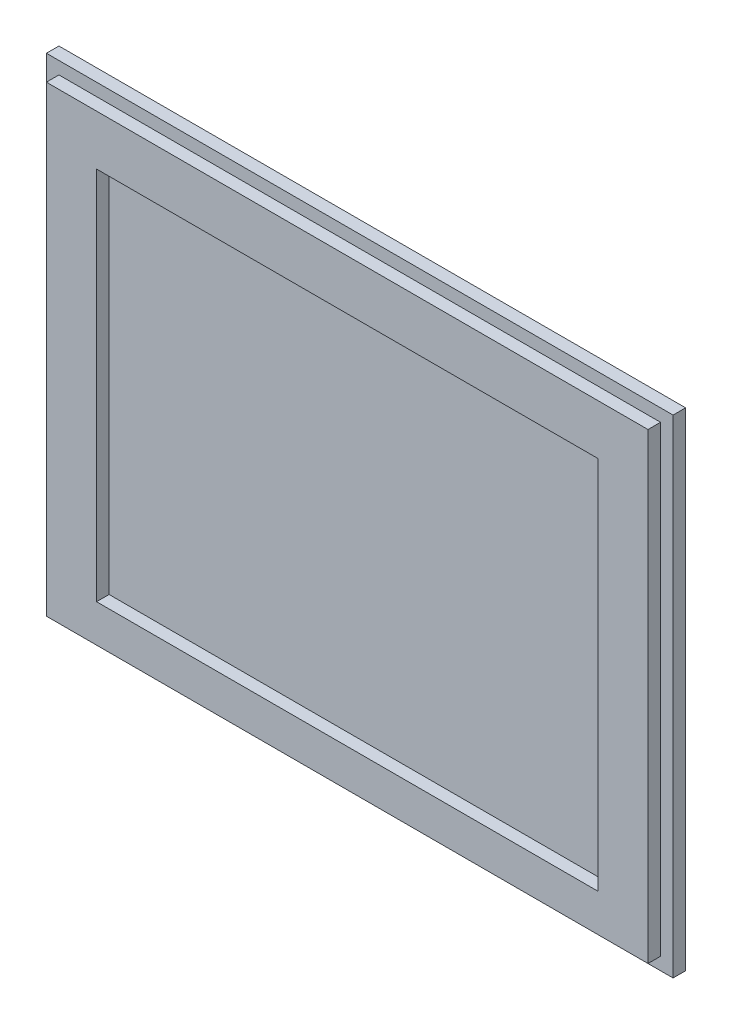
from build123d import *

# Parameters (mm, degrees)
SKIZZE1_W                       = 250
SKIZZE1_H                       = 194.5
AUFSATZ_LINEAR_AUSTRAGEN1_DEPTH = 5
SKIZZE2_W                       = 240
SKIZZE2_H                       = 184.5
SKIZZE2_W_2                     = 200
SKIZZE2_H_2                     = 149.5
AUFSATZ_LINEAR_AUSTRAGEN2_DEPTH = 5


with BuildPart() as part:
    # Skizze1 → Aufsatz-Linear austragen1 (new body)
    with BuildSketch(Plane.XY):
        with Locations((-5.266700495, 1.797169811)):
            Rectangle(SKIZZE1_W, SKIZZE1_H)
    extrude(amount=AUFSATZ_LINEAR_AUSTRAGEN1_DEPTH)

    # Skizze2 → Aufsatz-Linear austragen2 (add)
    with BuildSketch(Plane.XY.offset(5)):
        with Locations((-5.266700495, 1.797169811)):
            Rectangle(SKIZZE2_W, SKIZZE2_H)
        with Locations((-5.266700495, -0.702830189)):
            Rectangle(SKIZZE2_W_2, SKIZZE2_H_2, mode=Mode.SUBTRACT)
    extrude(amount=AUFSATZ_LINEAR_AUSTRAGEN2_DEPTH)


solid = part.part
